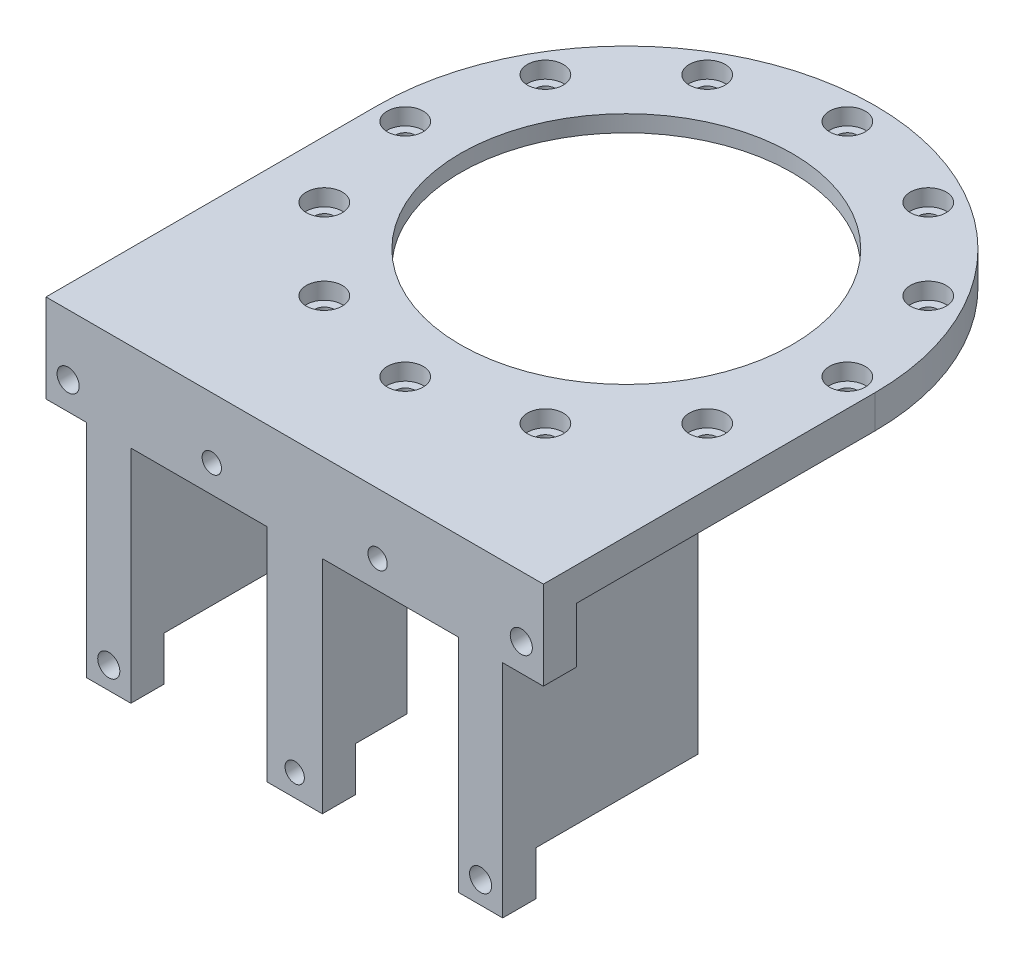
from build123d import *

# Parameters (mm, degrees)
SKETCH1_R           = 45
SKETCH1_R_2         = 30
SKETCH1_R_3         = 1.75
BOSS_EXTRUDE1_DEPTH = 6
SKETCH2_R           = 36
CUT_EXTRUDE1_DEPTH  = 3
SKETCH3_R           = 3.25
CUT_EXTRUDE2_DEPTH  = 3
BOSS_EXTRUDE4_DEPTH = 6
SKETCH5_W           = 90
SKETCH5_H           = 6
BOSS_EXTRUDE6_DEPTH = 10
BOSS_EXTRUDE7_START = 50
BOSS_EXTRUDE7_DEPTH = 50
SKETCH7_W           = 29.339223388
SKETCH7_H           = 8
CUT_EXTRUDE3_DEPTH  = 114.708124382
SKETCH8_R           = 2
SKETCH8_R_2         = 1.75
CUT_EXTRUDE5_DEPTH  = 120.691269523


with BuildPart() as part:
    # Sketch1 → Boss-Extrude1 (new body)
    with BuildSketch(Plane(origin=(0, 0, 0), x_dir=(1, 0, 0), z_dir=(0, 1, 0))):
        with Locations(Location((0, 0, 0), (0, 0, 270))):
            Circle(SKETCH1_R)
        with Locations(Location((0, 0, 0), (0, 0, 270))):
            Circle(SKETCH1_R_2, mode=Mode.SUBTRACT)
        with Locations(Location((0, 40, 0), (0, 0, 270))):
            Circle(SKETCH1_R_3, mode=Mode.SUBTRACT)
        with Locations(Location((20, 34.641016151, 0), (0, 0, 270))):
            Circle(SKETCH1_R_3, mode=Mode.SUBTRACT)
        with Locations(Location((34.641016151, 20, 0), (0, 0, 270))):
            Circle(SKETCH1_R_3, mode=Mode.SUBTRACT)
        with Locations(Location((40, 0, 0), (0, 0, 270))):
            Circle(SKETCH1_R_3, mode=Mode.SUBTRACT)
        with Locations(Location((34.641016151, -20, 0), (0, 0, 270))):
            Circle(SKETCH1_R_3, mode=Mode.SUBTRACT)
        with Locations(Location((20, -34.641016151, 0), (0, 0, 270))):
            Circle(SKETCH1_R_3, mode=Mode.SUBTRACT)
        with Locations(Location((0, -40, 0), (0, 0, 270))):
            Circle(SKETCH1_R_3, mode=Mode.SUBTRACT)
        with Locations(Location((-20, -34.641016151, 0), (0, 0, 270))):
            Circle(SKETCH1_R_3, mode=Mode.SUBTRACT)
        with Locations(Location((-34.641016151, -20, 0), (0, 0, 270))):
            Circle(SKETCH1_R_3, mode=Mode.SUBTRACT)
        with Locations(Location((-40, 0, 0), (0, 0, 270))):
            Circle(SKETCH1_R_3, mode=Mode.SUBTRACT)
        with Locations(Location((-34.641016151, 20, 0), (0, 0, 270))):
            Circle(SKETCH1_R_3, mode=Mode.SUBTRACT)
        with Locations(Location((-20, 34.641016151, 0), (0, 0, 270))):
            Circle(SKETCH1_R_3, mode=Mode.SUBTRACT)
    extrude(amount=BOSS_EXTRUDE1_DEPTH)

    # Sketch2 → Cut-Extrude1 (cut)
    with BuildSketch(Plane.XZ):
        with Locations(Location((0, 0, 0), (0, 0, 270))):
            Circle(SKETCH2_R)
    extrude(amount=-CUT_EXTRUDE1_DEPTH, mode=Mode.SUBTRACT)

    # Sketch3 → Cut-Extrude2 (cut)
    with BuildSketch(Plane(origin=(0, 6, 0), x_dir=(1, 0, 0), z_dir=(0, 1, 0))):
        with Locations(Location((40, 0, 0), (0, 0, 270))):
            Circle(SKETCH3_R)
        with Locations(Location((34.641016151, -20, 0), (0, 0, 270))):
            Circle(SKETCH3_R)
        with Locations(Location((20, -34.641016151, 0), (0, 0, 270))):
            Circle(SKETCH3_R)
        with Locations(Location((0, -40, 0), (0, 0, 270))):
            Circle(SKETCH3_R)
        with Locations(Location((-20, -34.641016151, 0), (0, 0, 270))):
            Circle(SKETCH3_R)
        with Locations(Location((-34.641016151, -20, 0), (0, 0, 270))):
            Circle(SKETCH3_R)
        with Locations(Location((-40, 0, 0), (0, 0, 270))):
            Circle(SKETCH3_R)
        with Locations(Location((-34.641016151, 20, 0), (0, 0, 270))):
            Circle(SKETCH3_R)
        with Locations(Location((-20, 34.641016151, 0), (0, 0, 270))):
            Circle(SKETCH3_R)
        with Locations(Location((0, 40, 0), (0, 0, 270))):
            Circle(SKETCH3_R)
        with Locations(Location((20, 34.641016151, 0), (0, 0, 270))):
            Circle(SKETCH3_R)
        with Locations(Location((34.641016151, 20, 0), (0, 0, 270))):
            Circle(SKETCH3_R)
    extrude(amount=-CUT_EXTRUDE2_DEPTH, mode=Mode.SUBTRACT)

    # Sketch4 → Boss-Extrude4 (add)
    with BuildSketch(Plane.XZ):
        with BuildLine():
            Line((45, 0), (45, 60))
            Line((45, 60), (-45, 60))
            Line((-45, 60), (-45, 0))
            ThreePointArc((-45, 0), (0, 45), (45, 0))
        make_face()
    extrude(amount=-BOSS_EXTRUDE4_DEPTH)

    # Sketch5 → Boss-Extrude6 (add)
    with BuildSketch(Plane.XZ):
        with Locations((0, 57)):
            Rectangle(SKETCH5_W, SKETCH5_H)
    extrude(amount=BOSS_EXTRUDE6_DEPTH)

    # Sketch6 → Boss-Extrude7 (add)
    with BuildSketch(Plane.XZ.offset(BOSS_EXTRUDE7_START)):
        with BuildLine():
            Line((37.641016151, 24.660776612), (37.641016151, 60))
            Line((37.641016151, 60), (29.641016151, 60))
            Line((29.641016151, 60), (29.641016151, 33.858679264))
            ThreePointArc((29.641016151, 33.858679264), (33.953914664, 29.531875643), (37.641016151, 24.660776612))
        make_face()
        with BuildLine():
            Line((-5, 60), (5, 60))
            Line((5, 60), (5, 44.72135955))
            ThreePointArc((5, 44.72135955), (0, 45), (-5, 44.72135955))
            Line((-5, 44.72135955), (-5, 60))
        make_face()
        with BuildLine():
            Line((-29.641016151, 60), (-29.641016151, 33.858679264))
            ThreePointArc((-29.641016151, 33.858679264), (-33.953914664, 29.531875643), (-37.641016151, 24.660776612))
            Line((-37.641016151, 24.660776612), (-37.641016151, 60))
            Line((-37.641016151, 60), (-29.641016151, 60))
        make_face()
    extrude(amount=-BOSS_EXTRUDE7_DEPTH)

    # Sketch7 → Cut-Extrude3 (cut, through all)
    with BuildSketch(Plane(origin=(37.641016151, 0, 0), x_dir=(0, 0, -1), z_dir=(1, 0, 0))):
        with Locations((-39.330388306, -46)):
            Rectangle(SKETCH7_W, SKETCH7_H)
    extrude(amount=-CUT_EXTRUDE3_DEPTH, mode=Mode.SUBTRACT)

    # Sketch8 → Cut-Extrude5 (cut, through all)
    with BuildSketch(Plane(origin=(0, 0, 54), x_dir=(-1, 0, 0), z_dir=(0, 0, -1))):
        with Locations((41, -5)):
            Circle(SKETCH8_R)
        with Locations((33.641016151, -46)):
            Circle(SKETCH8_R)
        with Locations((0, -46)):
            Circle(SKETCH8_R_2)
        with Locations((15, -5)):
            Circle(SKETCH8_R_2)
        with Locations((-33.641016151, -46)):
            Circle(SKETCH8_R)
        with Locations((-41, -5)):
            Circle(SKETCH8_R)
        with Locations((-15, -5)):
            Circle(SKETCH8_R_2)
    extrude(amount=-CUT_EXTRUDE5_DEPTH, mode=Mode.SUBTRACT)


solid = part.part
